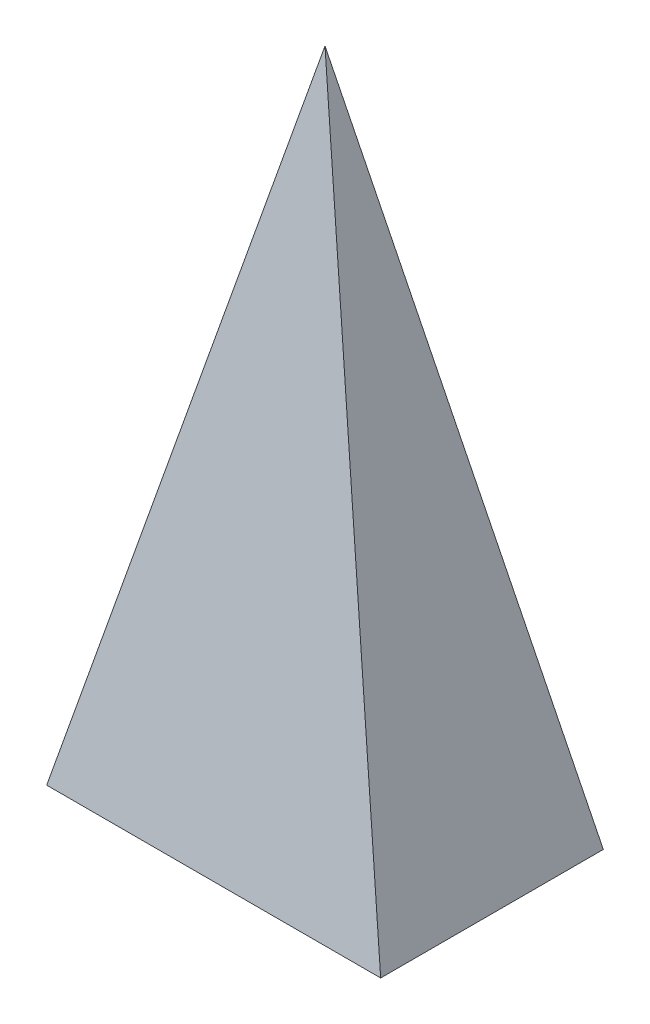
from build123d import *


with BuildPart() as part:
    # 草图1 → 放样1 section 0
    with BuildSketch(Plane(origin=(0, 0, 0), x_dir=(1, 0, 0), z_dir=(0, 1, 0)), mode=Mode.PRIVATE) as loft_1_s0:
        with BuildLine():
            Line((750, -500), (-750, -500))
            Line((-750, -500), (-750, 500))
            Line((-750, 500), (750, 500))
            Line((750, 500), (750, -500))
        make_face()
    loft([loft_1_s0.sketch, Vertex(0, 3000, 0)])


solid = part.part
